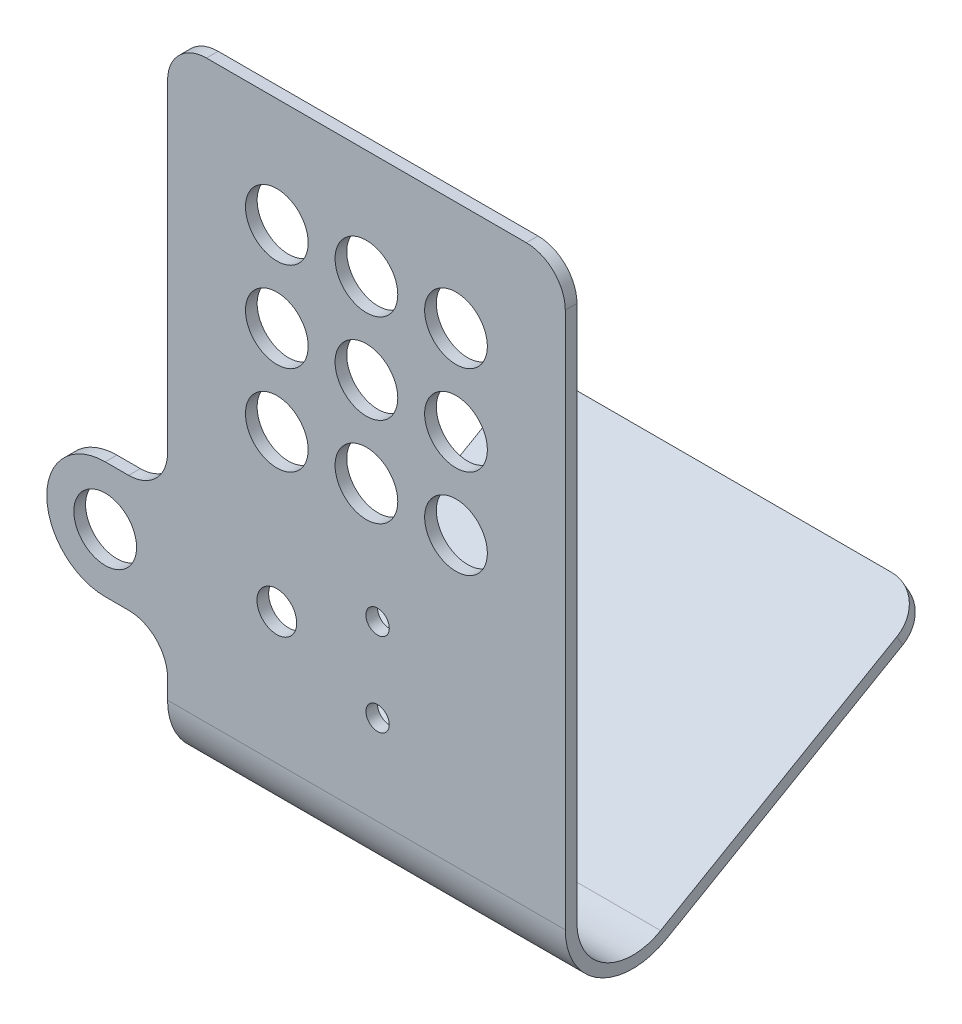
from build123d import *

# Parameters (mm, degrees)
SKETCH1_W           = 102.1
SKETCH1_H           = 147.765136106
SKETCH1_R           = 5.1
SKETCH1_R_2         = 3
SKETCH1_R_3         = 8.05
BOSS_EXTRUDE1_DEPTH = 3
BOSS_EXTRUDE2_DEPTH = 102.1
FILLET1_R           = 10
SKETCH3_R           = 8.05
BOSS_EXTRUDE3_DEPTH = 3
FILLET2_R           = 10


with BuildPart() as part:
    # Sketch1 → Boss-Extrude1 (new body)
    with BuildSketch(Plane.XY):
        with Locations((0, -22.832568053)):
            Rectangle(SKETCH1_W, SKETCH1_H)
        with Locations((-23, -63)):
            Circle(SKETCH1_R, mode=Mode.SUBTRACT)
        with Locations((2.86862691, -73.715136106)):
            Circle(SKETCH1_R_2, mode=Mode.SUBTRACT)
        with Locations((23, 23)):
            Circle(SKETCH1_R_3, mode=Mode.SUBTRACT)
        with Locations((0, -23)):
            Circle(SKETCH1_R_3, mode=Mode.SUBTRACT)
        with Locations((-23, -23)):
            Circle(SKETCH1_R_3, mode=Mode.SUBTRACT)
        Circle(SKETCH1_R_3, mode=Mode.SUBTRACT)
        with Locations((-23, 0)):
            Circle(SKETCH1_R_3, mode=Mode.SUBTRACT)
        with Locations((23, -23)):
            Circle(SKETCH1_R_3, mode=Mode.SUBTRACT)
        with Locations((23, 0)):
            Circle(SKETCH1_R_3, mode=Mode.SUBTRACT)
        with Locations((2.86862691, -52.284863894)):
            Circle(SKETCH1_R_2, mode=Mode.SUBTRACT)
        with Locations((0, 23)):
            Circle(SKETCH1_R_3, mode=Mode.SUBTRACT)
        with Locations((-23, 23)):
            Circle(SKETCH1_R_3, mode=Mode.SUBTRACT)
    extrude(amount=-BOSS_EXTRUDE1_DEPTH)

    # Sketch2 → Boss-Extrude2 (add)
    with BuildSketch(Plane.ZY.offset(51.05)):
        with BuildLine():
            Line((-24.480762114, -109.117059895), (-93.762794416, -69.117059895))
            Line((-93.762794416, -69.117059895), (-95.262794416, -71.715136106))
            Line((-95.262794416, -71.715136106), (-25.980762114, -111.715136106))
            ThreePointArc((-25.980762114, -111.715136106), (-8.660254038, -111.715136106), (0, -96.715136106))
            Line((0, -96.715136106), (-3, -96.715136106))
            ThreePointArc((-3, -96.715136106), (-10.160254038, -109.117059895), (-24.480762114, -109.117059895))
        make_face()
    extrude(amount=-BOSS_EXTRUDE2_DEPTH)

    # Fillet1
    fillet1_edges = [part.edges().sort_by_distance(p)[0] for p in [
        (51.05, 51.05, -1.5),
        (-51.05, 51.05, -1.5),
        (-51.05, -70.416098001, -94.512794416),
        (51.05, -70.416098001, -94.512794416),
    ]]
    fillet(fillet1_edges, radius=FILLET1_R)

    # Sketch3 → Boss-Extrude3 (add)
    with BuildSketch(Plane(origin=(0, 0, -3), x_dir=(-1, 0, 0), z_dir=(0, 0, -1))):
        with BuildLine():
            ThreePointArc((67.05, -81.715136106), (82.05, -66.715136106), (67.05, -51.715136106))
            Line((67.05, -51.715136106), (51.05, -51.715136106))
            Line((51.05, -51.715136106), (51.05, -81.715136106))
            Line((51.05, -81.715136106), (67.05, -81.715136106))
        make_face()
        with Locations((67.05, -66.715136106)):
            Circle(SKETCH3_R, mode=Mode.SUBTRACT)
    extrude(amount=-BOSS_EXTRUDE3_DEPTH)

    # Fillet2
    fillet2_edges = [part.edges().sort_by_distance(p)[0] for p in [
        (-51.05, -51.715136106, -1.5),
        (-51.05, -81.715136106, -1.5),
    ]]
    fillet(fillet2_edges, radius=FILLET2_R)


solid = part.part
